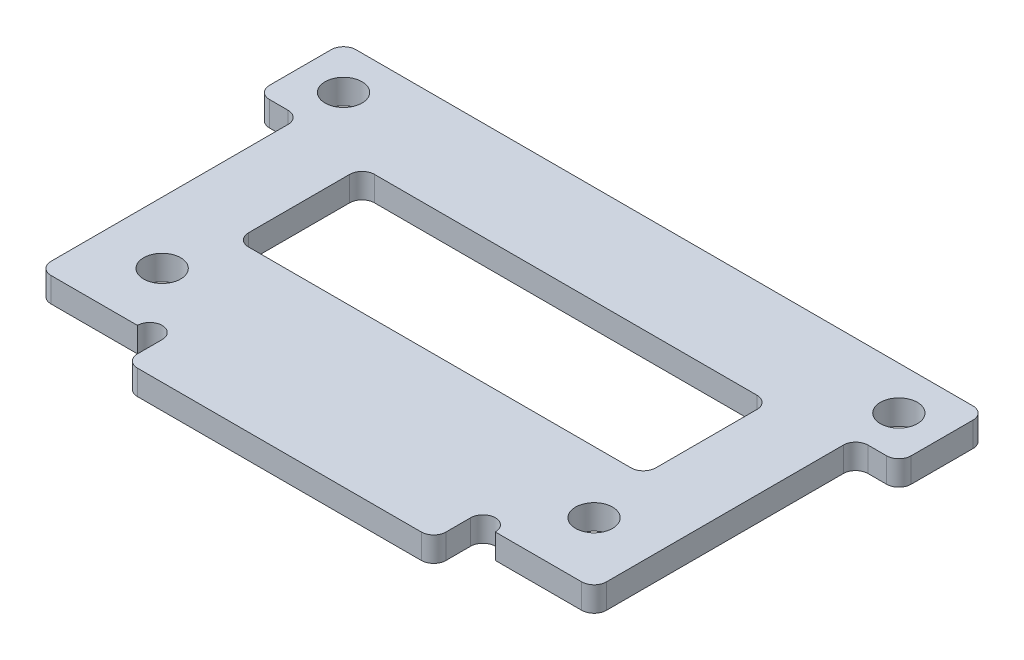
from build123d import *

# Parameters (mm, degrees)
SKETCH_1_R          = 1.5
EXTRUDE_1_DEPTH     = 2
SKETCH_2_R          = 1
SKETCH_2_W          = 33
SKETCH_2_H          = 10.2
CUT_EXTRUDE_1_DEPTH = 41.662513449
FILLET_1_R          = 1


with BuildPart() as part:
    # 草图1 → 凸台-拉伸1 (new body)
    with BuildSketch(Plane(origin=(0, 0, 0), x_dir=(1, 0, 0), z_dir=(0, 1, 0))):
        Polygon((-22.5, 3), (-22.5, 24.2), (-26, 24.2), (-26, 31.2), (26, 31.2), (26, 24.2), (22.5, 24.2), (22.5, 3), (12.5, 3), (12.5, 0), (-12.5, 0), (-12.5, 3), align=None)
        with Locations(Location((-22.5, 27.7, 0), (0, 0, 270))):
            Circle(SKETCH_1_R, mode=Mode.SUBTRACT)
        with Locations(Location((22.5, 27.7, 0), (0, 0, 90))):
            Circle(SKETCH_1_R, mode=Mode.SUBTRACT)
        with Locations(Location((-17.5, 8, 0), (0, 0, 270))):
            Circle(SKETCH_1_R, mode=Mode.SUBTRACT)
        with Locations(Location((17.5, 8, 0), (0, 0, 90))):
            Circle(SKETCH_1_R, mode=Mode.SUBTRACT)
    extrude(amount=EXTRUDE_1_DEPTH)

    # 草图2 → 切除-拉伸1 (cut, through all)
    with BuildSketch(Plane(origin=(0, 2, 0), x_dir=(1, 0, 0), z_dir=(0, 1, 0))):
        with Locations((-13.5, 3)):
            Circle(SKETCH_2_R)
        with Locations((13.5, 3)):
            Circle(SKETCH_2_R)
        with Locations((0, 18.1)):
            Rectangle(SKETCH_2_W, SKETCH_2_H)
    extrude(amount=-CUT_EXTRUDE_1_DEPTH, mode=Mode.SUBTRACT)

    # 圆角1
    fillet_1_edges = [part.edges().sort_by_distance(p)[0] for p in [
        (26, 1, -24.2),
        (22.5, 1, -24.2),
        (22.5, 1, -3),
        (12.5, 1, 0),
        (-12.5, 1, 0),
        (-22.5, 1, -3),
        (-22.5, 1, -24.2),
        (-26, 1, -24.2),
        (-26, 1, -31.2),
        (26, 1, -31.2),
        (-16.5, 1, -13),
        (-16.5, 1, -23.2),
        (16.5, 1, -23.2),
        (16.5, 1, -13),
    ]]
    fillet(fillet_1_edges, radius=FILLET_1_R)


solid = part.part
